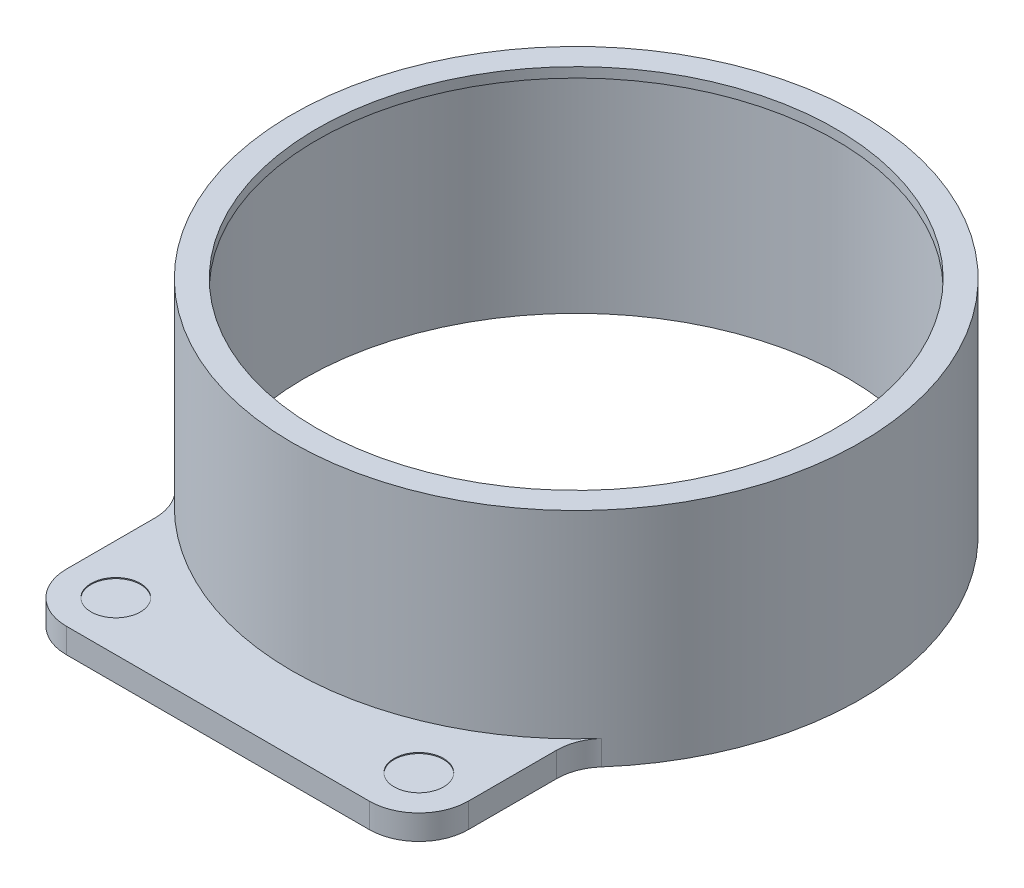
from build123d import *

# Parameters (mm, degrees)
SKETCH1_R           = 69.865875
SKETCH1_R_2         = 66.675
BOSS_EXTRUDE1_DEPTH = 2.54
BOSS_EXTRUDE2_START = -57.15
SKETCH2_R           = 73.025
SKETCH2_R_2         = 69.865875
BOSS_EXTRUDE2_DEPTH = 57.15
BOSS_EXTRUDE3_DEPTH = 6.35
FILLET2_R           = 12.7
SKETCH4_R           = 6.35
CUT_EXTRUDE1_DEPTH  = 0.254


with BuildPart() as part:
    # Sketch1 → Boss-Extrude1 (new body)
    with BuildSketch(Plane(origin=(0, 0, 0), x_dir=(1, 0, 0), z_dir=(0, 1, 0))):
        with Locations(Location((0, 0, 0), (0, 0, 270))):
            Circle(SKETCH1_R)
        with Locations(Location((0, 0, 0), (0, 0, 270))):
            Circle(SKETCH1_R_2, mode=Mode.SUBTRACT)
    extrude(amount=BOSS_EXTRUDE1_DEPTH)

    # Sketch2 → Boss-Extrude2 (add)
    with BuildSketch(Plane(origin=(0, 2.54, 0), x_dir=(1, 0, 0), z_dir=(0, 1, 0)).offset(BOSS_EXTRUDE2_START)):
        with Locations(Location((0, 0, 0), (0, 0, 270))):
            Circle(SKETCH2_R)
        with Locations(Location((0, 0, 0), (0, 0, 270))):
            Circle(SKETCH2_R_2, mode=Mode.SUBTRACT)
    extrude(amount=BOSS_EXTRUDE2_DEPTH)

    # Sketch3 → Boss-Extrude3 (add)
    with BuildSketch(Plane.XZ.offset(54.61)):
        with BuildLine():
            Line((-51.636472696, 51.636472696), (-51.636472696, 92.075))
            Line((-51.636472696, 92.075), (51.636472696, 92.075))
            Line((51.636472696, 92.075), (51.636472696, 51.636472696))
            ThreePointArc((51.636472696, 51.636472696), (0, 73.025), (-51.636472696, 51.636472696))
        make_face()
    extrude(amount=-BOSS_EXTRUDE3_DEPTH)

    # Fillet2
    fillet2_edges = [part.edges().sort_by_distance(p)[0] for p in [
        (51.636472696, -51.435, 51.636472696),
        (-51.636472696, -51.435, 51.636472696),
        (-51.636472696, -51.435, 92.075),
        (51.636472696, -51.435, 92.075),
    ]]
    fillet(fillet2_edges, radius=FILLET2_R)

    # Sketch4 → Cut-Extrude1 (cut)
    with BuildSketch(Plane(origin=(0, -48.26, 0), x_dir=(1, 0, 0), z_dir=(0, 1, 0))):
        with Locations(Location((-38.936472696, -79.375, 0), (0, 0, 270))):
            Circle(SKETCH4_R)
        with Locations(Location((38.936472696, -79.375, 0), (0, 0, 270))):
            Circle(SKETCH4_R)
    extrude(amount=-CUT_EXTRUDE1_DEPTH, mode=Mode.SUBTRACT)


solid = part.part
